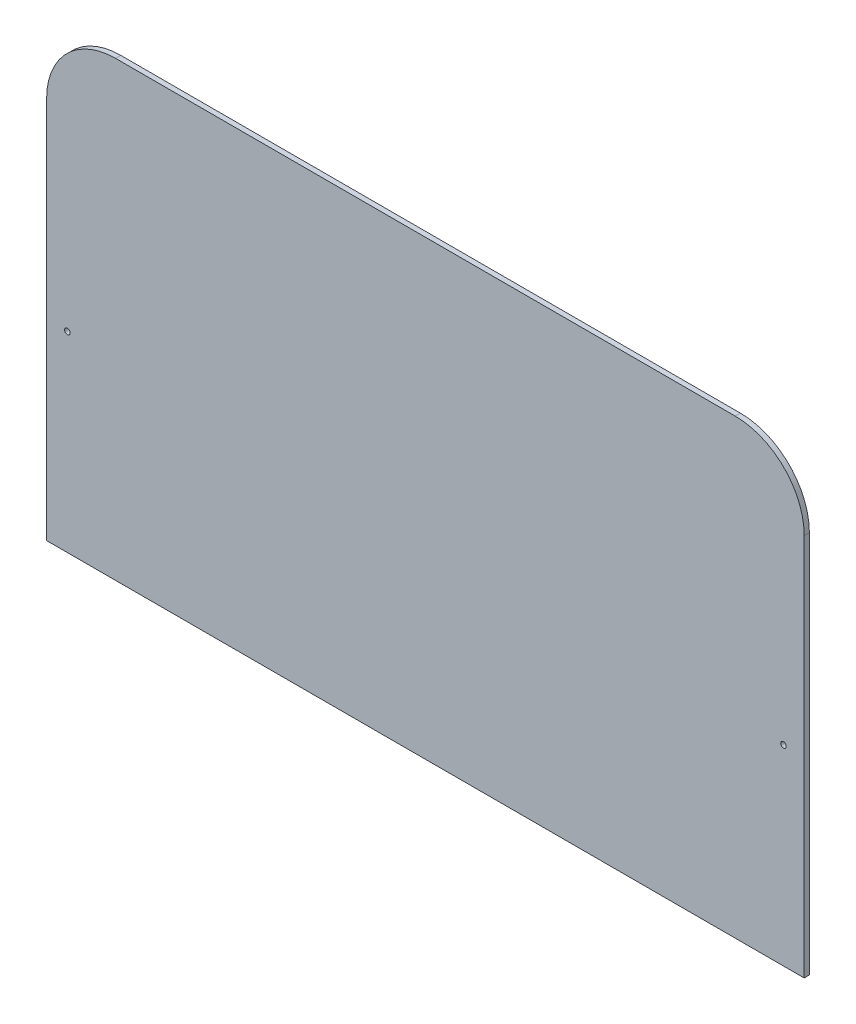
from build123d import *

# Parameters (mm, degrees)
ESQUISSE1_W        = 439
ESQUISSE1_H        = 262
BOSS_EXTRU_1_DEPTH = 3
FILLET1_R          = 40
SKETCH1_R          = 1.6
CUT_EXTRUDE1_DEPTH = 256.636949598
SKETCH2_R          = 1.6
CUT_EXTRUDE2_DEPTH = 256.636949598


with BuildPart() as part:
    # Esquisse1 → Boss.-Extru.1 (new body)
    with BuildSketch(Plane.XY):
        Rectangle(ESQUISSE1_W, ESQUISSE1_H)
    extrude(amount=BOSS_EXTRU_1_DEPTH)

    # Fillet1
    fillet1_edges = [part.edges().sort_by_distance(p)[0] for p in [
        (219.5, 131, 1.5),
        (-219.5, 131, 1.5),
    ]]
    fillet(fillet1_edges, radius=FILLET1_R)

    # Sketch1 → Cut-Extrude1 (cut, through all)
    with BuildSketch(Plane.XY.offset(3)):
        with Locations((-207.5, -20)):
            Circle(SKETCH1_R)
    extrude(amount=-CUT_EXTRUDE1_DEPTH, mode=Mode.SUBTRACT)

    # Sketch2 → Cut-Extrude2 (cut, through all)
    with BuildSketch(Plane.XY.offset(3)):
        with Locations((207.5, -20)):
            Circle(SKETCH2_R)
    extrude(amount=-CUT_EXTRUDE2_DEPTH, mode=Mode.SUBTRACT)


solid = part.part
